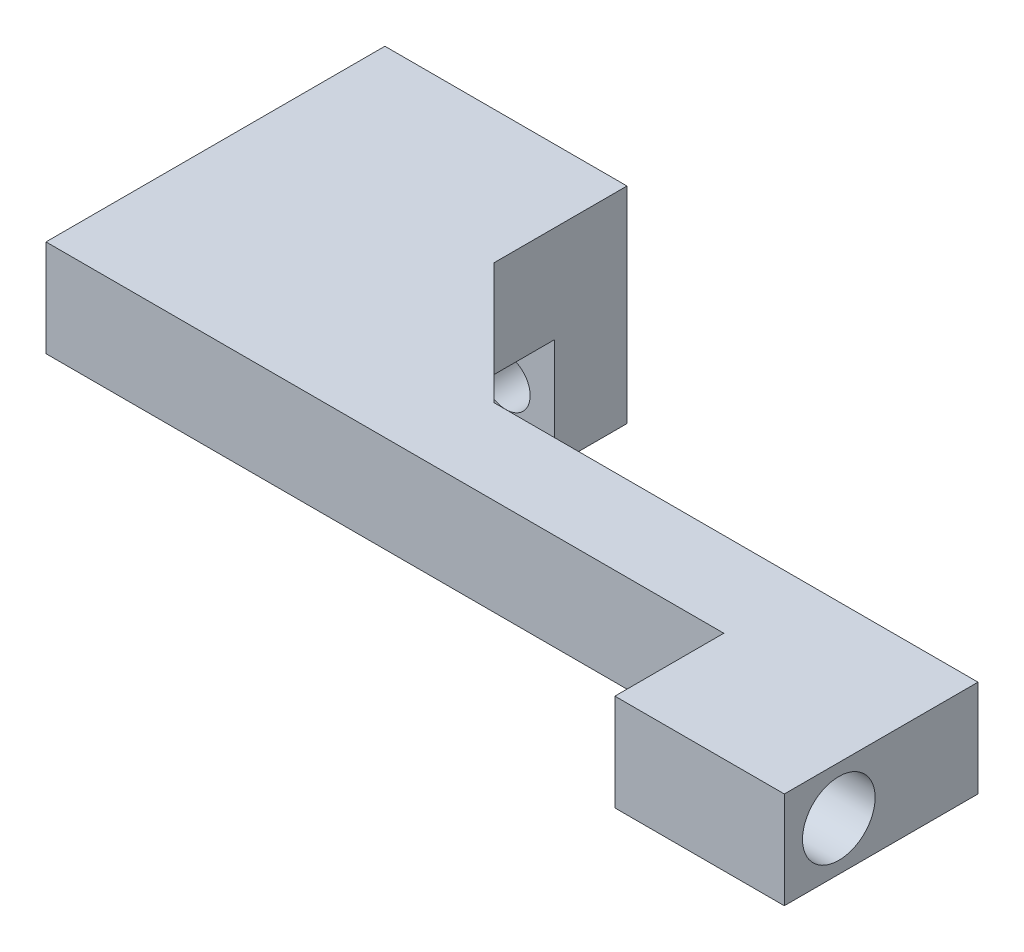
from build123d import *

# Parameters (mm, degrees)
BOSS_EXTRUDE1_DEPTH = 8
SKETCH2_W           = 6
SKETCH2_H           = 9
BOSS_EXTRUDE2_DEPTH = 20
CUT_EXTRUDE1_REACH  = 71.239
SKETCH3_R           = 3
SKETCH4_R           = 2
CUT_EXTRUDE2_DEPTH  = 10


with BuildPart() as part:
    # Sketch1 → Boss-Extrude1 (new body)
    with BuildSketch(Plane(origin=(0, 0, 0), x_dir=(1, 0, 0), z_dir=(0, 1, 0))):
        Polygon((0, 0), (0, -28), (56, -28), (56, -37), (70, -37), (70, -21), (30, -21), (20, -11), (20, 0), align=None)
    extrude(amount=-BOSS_EXTRUDE1_DEPTH)

    # Sketch2 → Boss-Extrude2 (add)
    with BuildSketch(Plane.ZY):
        with Locations((3, -12.5)):
            Rectangle(SKETCH2_W, SKETCH2_H)
    extrude(amount=-BOSS_EXTRUDE2_DEPTH)

    # Sketch3 → Cut-Extrude1 (cut, up to next)
    with BuildSketch(Plane.ZY.offset(-56), mode=Mode.PRIVATE) as cut_extrude1_sk1:
        with Locations((32.5, -4)):
            Circle(SKETCH3_R)
    cut_extrude1_tool1 = extrude(cut_extrude1_sk1.sketch, amount=-CUT_EXTRUDE1_REACH, mode=Mode.PRIVATE) & part.part
    add(cut_extrude1_tool1.solids().sort_by_distance((56, -4, 32.5))[0], mode=Mode.SUBTRACT)

    # Sketch4 → Cut-Extrude2 (cut)
    with BuildSketch(Plane.XY.offset(6)):
        with Locations((4, -13)):
            Circle(SKETCH4_R)
        with Locations((16, -13)):
            Circle(SKETCH4_R)
    extrude(amount=-CUT_EXTRUDE2_DEPTH, mode=Mode.SUBTRACT)


solid = part.part
